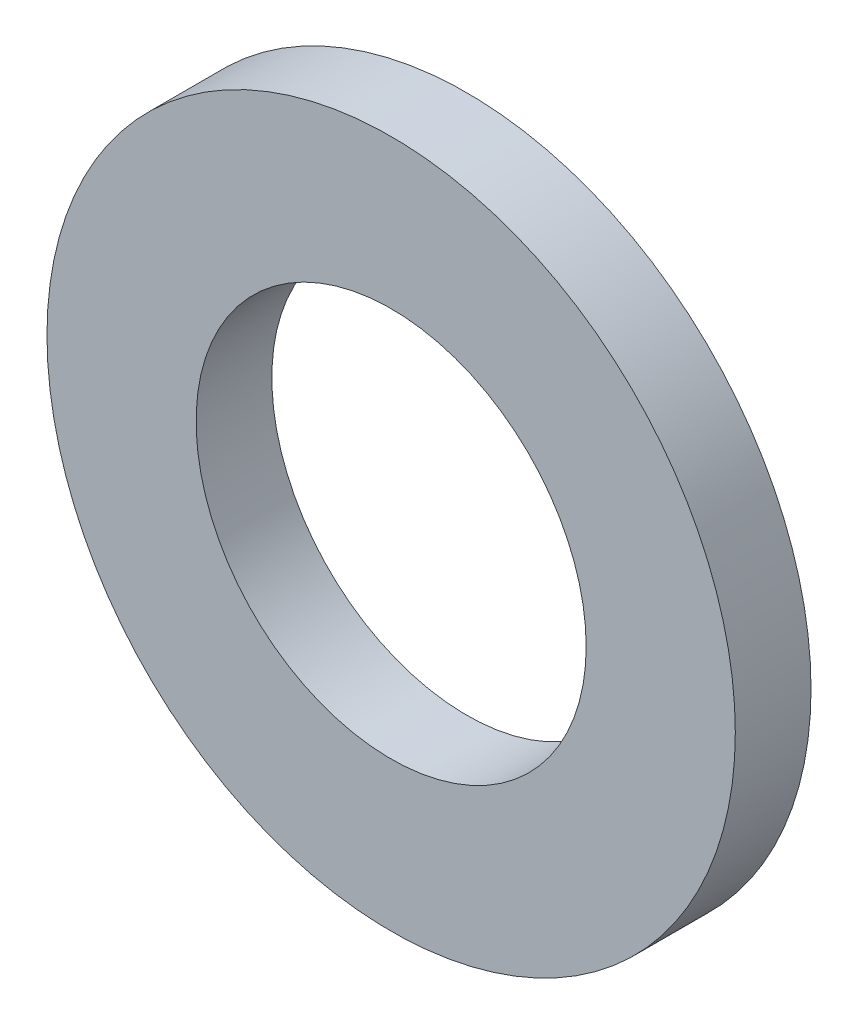
from build123d import *

# Parameters (mm, degrees)
SKETCH1_R           = 15
SKETCH1_R_2         = 8.5
BOSS_EXTRUDE1_DEPTH = 3.3


with BuildPart() as part:
    # Sketch1 → Boss-Extrude1 (new body)
    with BuildSketch(Plane.XY):
        Circle(SKETCH1_R)
        Circle(SKETCH1_R_2, mode=Mode.SUBTRACT)
    extrude(amount=BOSS_EXTRUDE1_DEPTH)


solid = part.part
